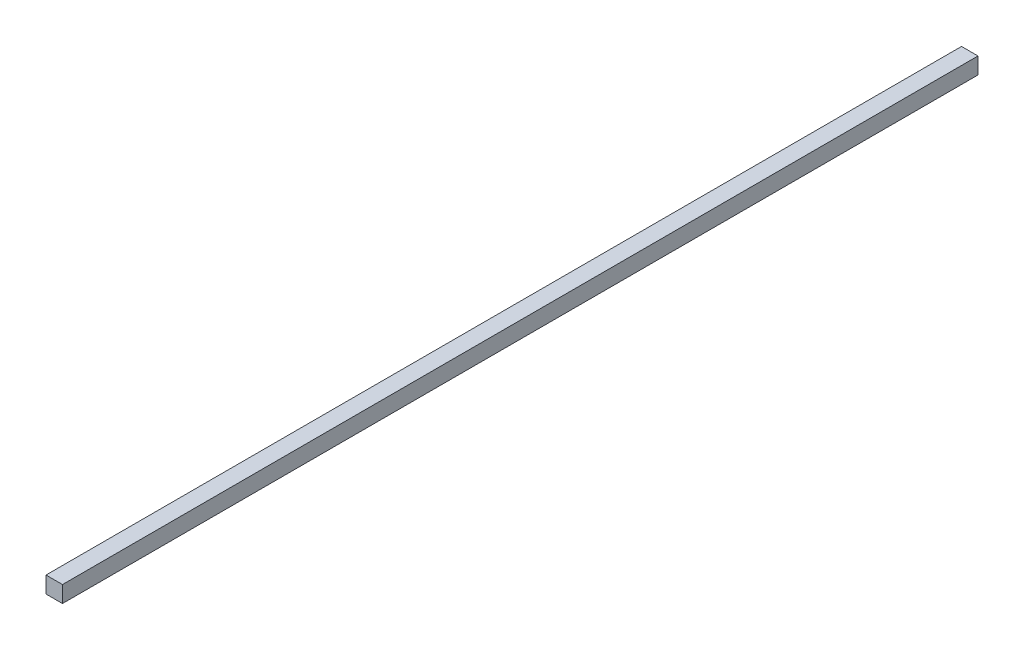
from build123d import *

# Parameters (mm, degrees)
SKETCH1_W      = 22.86
SKETCH1_H      = 22.86
EXTRUDE1_DEPTH = 1270


with BuildPart() as part:
    # Sketch1 → Extrude1 (new body)
    with BuildSketch(Plane.XY):
        with Locations((11.43, 11.43)):
            Rectangle(SKETCH1_W, SKETCH1_H)
    extrude(amount=EXTRUDE1_DEPTH)


solid = part.part
